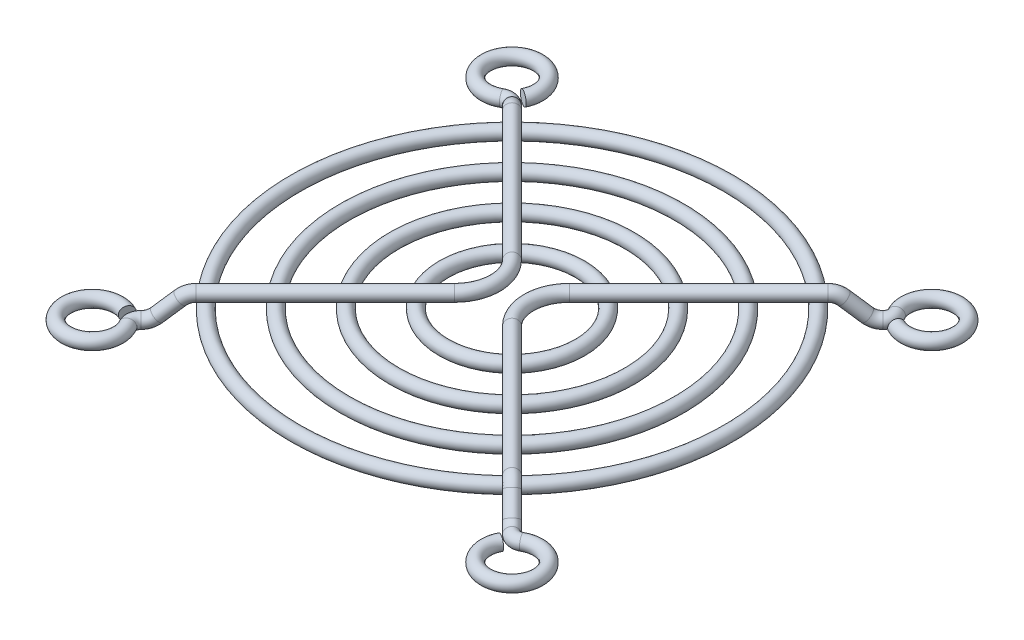
from build123d import *

# Parameters (mm, degrees)
SKETCH1_R               = 0.8
SKETCH3_R               = 0.8
SKETCH5_R               = 0.8
SKETCH7_R               = 0.8
CUT_EXTRUDE1_DEPTH      = 42.106933873
CUT_EXTRUDE1_DEPTH_BACK = 42.106933873
CIRPATTERN1_COUNT       = 4
SKETCH10_R              = 0.8
SKETCH12_R              = 0.8


with BuildPart() as part:
    # Sketch1 → Revolve1 (revolve)
    with BuildSketch(Plane.XY, mode=Mode.PRIVATE) as revolve1_sk:
        with Locations((-8.1, 2)):
            Circle(SKETCH1_R)
        with Locations((-25.8, 2)):
            Circle(SKETCH1_R)
        with Locations((-19.9, 2)):
            Circle(SKETCH1_R)
        with Locations((-14, 2)):
            Circle(SKETCH1_R)
    revolve(revolve1_sk.sketch.rotate(Axis((0, 2, 0), (0, -1, 0)), 270), axis=Axis((0, 2, 0), (0, -1, 0)))


with BuildPart() as body_2:
    # Sweep1: sweep along a path in Sketch2
    with BuildLine(Plane(origin=(0, 0, 0), x_dir=(1, 0, 0), z_dir=(0, 1, 0))) as sweep1_path:
        Line((-18.816111447, 18.816111447), (-3.414213562, 3.414213562))
        ThreePointArc((-3.414213562, 3.414213562), (-2.36754213, 1.847759065), (-2, 0))
    # Sketch3 → Sweep1 (sweep)
    with BuildSketch(Plane.XY):
        with Locations((-2, 3.6)):
            Circle(SKETCH3_R)
    sweep(path=sweep1_path.line)

    # Sweep2: sweep along a path in Sketch4
    with BuildLine(Plane(origin=(0, 0, 0), x_dir=(-0.7071067811865488, 0, -0.7071067811865464), z_dir=(0.7071067811865464, 0, -0.7071067811865488))) as sweep2_path:
        ThreePointArc((26.61, 3.6), (27.326696314, 3.467176048), (27.948198192, 3.086346393))
        Line((27.948198192, 3.086346393), (29.917140868, 1.313653607))
        ThreePointArc((29.917140868, 1.313653607), (30.538642745, 0.932823952), (31.255339059, 0.8))
    # Sketch5 → Sweep2 (sweep)
    with BuildSketch(Plane(origin=(-18.816111447, 0, -18.816111447), x_dir=(-0.7071067811865516, 0, 0.7071067811865435), z_dir=(-0.7071067811865435, 0, -0.7071067811865516))):
        with Locations((0, 3.6)):
            Circle(SKETCH5_R)
    sweep(path=sweep2_path.line)

    # Sweep3: sweep along a path in Sketch6
    with BuildLine(Plane(origin=(0, 0, 0), x_dir=(1, 0, 0), z_dir=(0, 1, 0))) as sweep3_path:
        ThreePointArc((-22.100862197, 22.100862197), (-22.762261641, 22.429955027), (-23.488311688, 22.293563515))
        ThreePointArc((-23.488311688, 22.293563515), (-27.23046916, 27.152906716), (-22.241776821, 23.585007104))
    # Sketch7 → Sweep3 (sweep)
    with BuildSketch(Plane(origin=(-22.100862197, 0, -22.100862197), x_dir=(-0.7071067811865515, 2.0261570199408882e-15, 0.7071067811865437), z_dir=(-0.7071067811865437, -2.0261570199409115e-15, -0.7071067811865515))):
        with Locations((0, 0.8)):
            Circle(SKETCH7_R)
    sweep(path=sweep3_path.line)

    # Sketch8 → Cut-Extrude1 (cut, two sides: drawn at the far end of the back side and taken through both)
    with BuildSketch(Plane(origin=(0, 0, 0), x_dir=(1, 0, 0), z_dir=(0, 1, 0)).offset(-CUT_EXTRUDE1_DEPTH_BACK)):
        Polygon((-71.090054793, -64.261627668), (-3.979898987, 2.848528137), (-2.848528137, 3.979898987), (64.261627668, 71.090054793), (198.481939278, -63.130256818), (63.130256818, -198.481939278), align=None)
    extrude(amount=CUT_EXTRUDE1_DEPTH + CUT_EXTRUDE1_DEPTH_BACK, mode=Mode.SUBTRACT)


with BuildPart() as cirpattern1_1:
    # CirPattern1: pattern copy
    add(body_2.part.rotate(Axis((0, 0, 0), (0, 1, 0)), 1 * 360 / CIRPATTERN1_COUNT))


with BuildPart() as cirpattern1_2:
    # CirPattern1: pattern copy
    add(body_2.part.rotate(Axis((0, 0, 0), (0, 1, 0)), 2 * 360 / CIRPATTERN1_COUNT))



with BuildPart() as cirpattern1_3:
    # CirPattern1: pattern copy
    add(body_2.part.rotate(Axis((0, 0, 0), (0, 1, 0)), 3 * 360 / CIRPATTERN1_COUNT))


with BuildPart() as body_2_1:
    add(body_2.part)

    add(cirpattern1_1.part)  # Sweep4 merges CirPattern1_1
    # Sweep4: sweep along a path in Sketch9
    with BuildLine(Plane(origin=(0, 0, 0), x_dir=(1, 0, 0), z_dir=(0, 1, 0))) as sweep4_path:
        ThreePointArc((-3.414213562, 3.414213562), (-2, 0), (-3.414213562, -3.414213562))
    # Sketch10 → Sweep4 (sweep)
    with BuildSketch(Plane(origin=(-3.414213562, 0, -3.414213562), x_dir=(0.7071067811865474, 0, -0.7071067811865477), z_dir=(0.7071067811865477, 0, 0.7071067811865474))):
        with Locations((0, 3.6)):
            Circle(SKETCH10_R)
    sweep(path=sweep4_path.line)


with BuildPart() as cirpattern1_2_1:
    add(cirpattern1_2.part)

    add(cirpattern1_3.part)  # Sweep5 merges CirPattern1_3
    # Sweep5: sweep along a path in Sketch11
    with BuildLine(Plane(origin=(0, 0, 0), x_dir=(1, 0, 0), z_dir=(0, 1, 0))) as sweep5_path:
        ThreePointArc((3.414213562, 3.414213562), (2, 0), (3.414213562, -3.414213562))
    # Sketch12 → Sweep5 (sweep)
    with BuildSketch(Plane(origin=(3.414213562, 0, -3.414213562), x_dir=(0.7071067811865551, 2.0443912222444393e-15, 0.7071067811865399), z_dir=(-0.7071067811865399, 2.044391222244483e-15, 0.7071067811865551))):
        with Locations((0, 3.6)):
            Circle(SKETCH12_R)
    sweep(path=sweep5_path.line)


solid = Compound([part.part, body_2_1.part, cirpattern1_2_1.part])
